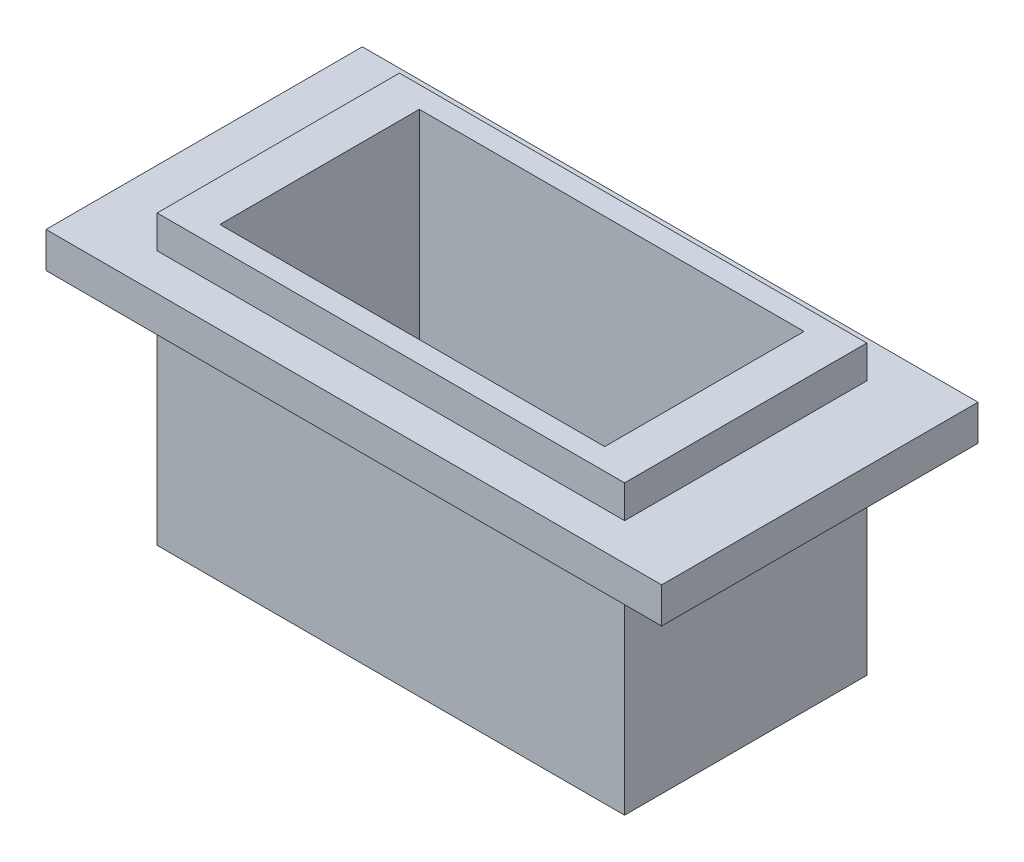
from build123d import *

# Parameters (mm, degrees)
SKETCH1_W                = 54.864
SKETCH1_H                = 28.194
SKETCH1_W_2              = 41.656
SKETCH1_H_2              = 21.59
BOSS_EXTRUDE1_DEPTH      = 3.175
BOSS_EXTRUDE2_DEPTH      = 6.096
BOSS_EXTRUDE2_DEPTH_BACK = 19.558
SKETCH1_3_W              = 41.656
SKETCH1_3_H              = 21.59
SKETCH1_3_W_2            = 34.29
SKETCH1_3_H_2            = 17.772256098


with BuildPart() as part:
    # Sketch1 → Boss-Extrude1 (new body)
    with BuildSketch(Plane(origin=(0, 0, 0), x_dir=(1, 0, 0), z_dir=(0, 1, 0))):
        with Locations((27.432, 14.097)):
            Rectangle(SKETCH1_W, SKETCH1_H)
        with Locations((27.432, 14.097)):
            Rectangle(SKETCH1_W_2, SKETCH1_H_2, mode=Mode.SUBTRACT)
    extrude(amount=BOSS_EXTRUDE1_DEPTH)

    # Sketch1<3> → Boss-Extrude2 (add, two sides: drawn at the far end of the back side and taken through both)
    with BuildSketch(Plane(origin=(0, 0, 0), x_dir=(1, 0, 0), z_dir=(0, 1, 0)).offset(-BOSS_EXTRUDE2_DEPTH_BACK)):
        with Locations((27.432, 14.097)):
            Rectangle(SKETCH1_3_W, SKETCH1_3_H)
        with Locations((27.432, 14.097)):
            Rectangle(SKETCH1_3_W_2, SKETCH1_3_H_2, mode=Mode.SUBTRACT)
    extrude(amount=BOSS_EXTRUDE2_DEPTH + BOSS_EXTRUDE2_DEPTH_BACK)


solid = part.part
